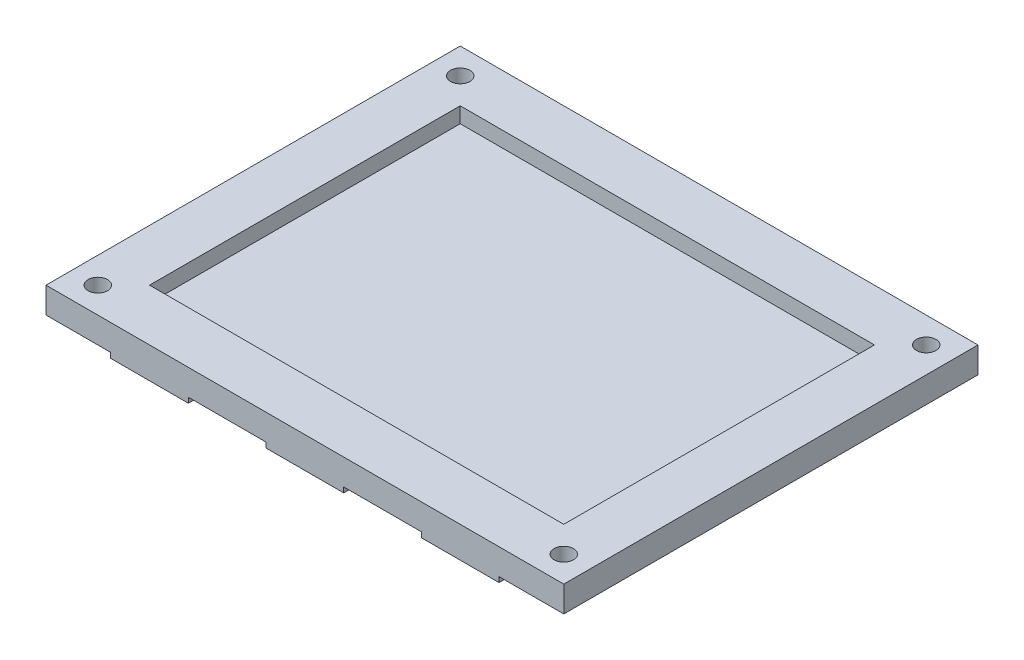
from build123d import *

# Parameters (mm, degrees)
SKETCH1_W           = 200
SKETCH1_H           = 160
BOSS_EXTRUDE3_DEPTH = 10
SKETCH3_R           = 3.75
SKETCH3_W           = 160
SKETCH3_H           = 120
CUT_EXTRUDE2_DEPTH  = 6
SKETCH6_R           = 3.75
CUT_EXTRUDE4_DEPTH  = 129.202964084
SKETCH7_W           = 30
SKETCH7_H           = 160
BOSS_EXTRUDE4_DEPTH = 2


with BuildPart() as part:
    # Sketch1 → Boss-Extrude3 (new body)
    with BuildSketch(Plane(origin=(0, 0, 0), x_dir=(1, 0, 0), z_dir=(0, 1, 0))):
        Rectangle(SKETCH1_W, SKETCH1_H)
    extrude(amount=BOSS_EXTRUDE3_DEPTH)

    # Sketch3 → Cut-Extrude2 (cut)
    with BuildSketch(Plane(origin=(0, 10, 0), x_dir=(1, 0, 0), z_dir=(0, 1, 0))):
        with Locations(Location((-90, 70, 0), (0, 0, 270))):
            Circle(SKETCH3_R)
        with Locations(Location((90, -70, 0), (0, 0, 270))):
            Circle(SKETCH3_R)
        with Locations(Location((90, 70, 0), (0, 0, 270))):
            Circle(SKETCH3_R)
        with Locations(Location((-90, -70, 0), (0, 0, 270))):
            Circle(SKETCH3_R)
        Rectangle(SKETCH3_W, SKETCH3_H)
    extrude(amount=-CUT_EXTRUDE2_DEPTH, mode=Mode.SUBTRACT)

    # Sketch6 → Cut-Extrude4 (cut, through all)
    with BuildSketch(Plane(origin=(0, 4, 0), x_dir=(1, 0, 0), z_dir=(0, 1, 0))):
        with Locations(Location((-90, 70, 0), (0, 0, 270))):
            Circle(SKETCH6_R)
        with Locations(Location((90, 70, 0), (0, 0, 270))):
            Circle(SKETCH6_R)
        with Locations(Location((90, -70, 0), (0, 0, 270))):
            Circle(SKETCH6_R)
        with Locations(Location((-90, -70, 0), (0, 0, 270))):
            Circle(SKETCH6_R)
    extrude(amount=-CUT_EXTRUDE4_DEPTH, mode=Mode.SUBTRACT)

    # Sketch7 → Boss-Extrude4 (add)
    with BuildSketch(Plane(origin=(0, 0, 0), x_dir=(-1, 0, 0), z_dir=(0, -1, 0))):
        Rectangle(SKETCH7_W, SKETCH7_H)
        with Locations((60, 0)):
            Rectangle(SKETCH7_W, SKETCH7_H)
        with Locations((-60, 0)):
            Rectangle(SKETCH7_W, SKETCH7_H)
    extrude(amount=BOSS_EXTRUDE4_DEPTH)


solid = part.part
